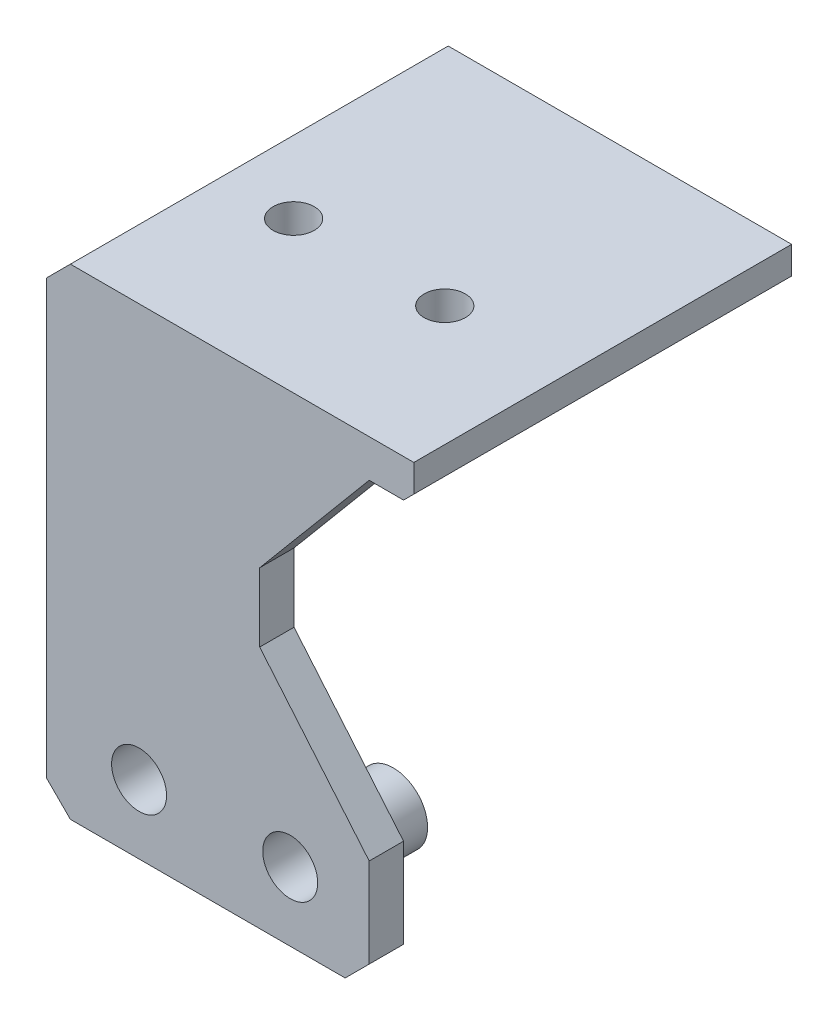
from build123d import *

# Parameters (mm, degrees)
BOSS_EXTRUDE1_DEPTH     = 5
BOSS_EXTRUDE2_DEPTH     = 50
SKETCH5_R               = 3
CUT_EXTRUDE1_DEPTH      = 94.713659623
SKETCH6_R               = 5
SKETCH6_R_2             = 4
BOSS_EXTRUDE3_DEPTH     = 10
SKETCH5_3_R             = 5
SKETCH5_3_R_2           = 3
CUT_EXTRUDE2_DEPTH      = 4
ESQUISSE1_R             = 4
ENL_V_MAT_EXTRU_1_DEPTH = 100.498743711


with BuildPart() as part:
    # Sketch1 → Boss-Extrude1 (new body)
    with BuildSketch(Plane.XY):
        Polygon((40, -70), (43.5, -66.5), (43.5, -53.5), (27.557107008, -34.5), (27.557107008, -24.5), (43.5, -5.5), (48.5, -5.5), (50, -4), (50, 0), (0, 0), (-3.5, -3.5), (-3.5, -66.5), (0, -70), align=None)
    extrude(amount=BOSS_EXTRUDE1_DEPTH)

    # Sketch4 → Boss-Extrude2 (add)
    with BuildSketch(Plane(origin=(0, 0, 0), x_dir=(-1, 0, 0), z_dir=(0, 0, -1))):
        Polygon((-50, 0), (-50, -4), (-45.5, -8.5), (3.5, -8.5), (3.5, -3.5), (0, 0), align=None)
    extrude(amount=BOSS_EXTRUDE2_DEPTH)

    # Sketch5 → Cut-Extrude1 (cut, through all)
    with BuildSketch(Plane.XZ.offset(8.5)):
        with Locations((32.5, -17)):
            Circle(SKETCH5_R)
        with Locations((10.5, -17)):
            Circle(SKETCH5_R)
    extrude(amount=-CUT_EXTRUDE1_DEPTH, mode=Mode.SUBTRACT)

    # Sketch6 → Boss-Extrude3 (add)
    # profile 1 of 2: a face of its own
    with BuildSketch(Plane(origin=(0, 0, 0), x_dir=(-1, 0, 0), z_dir=(0, 0, -1))):
        with Locations((-10, -60)):
            Circle(SKETCH6_R)
        with Locations((-10, -60)):
            Circle(SKETCH6_R_2, mode=Mode.SUBTRACT)
    # profile 2 of 2: a face of its own
    with BuildSketch(Plane(origin=(0, 0, 0), x_dir=(-1, 0, 0), z_dir=(0, 0, -1))):
        with Locations((-32, -60)):
            Circle(SKETCH6_R)
        with Locations((-32, -60)):
            Circle(SKETCH6_R_2, mode=Mode.SUBTRACT)
    extrude(amount=BOSS_EXTRUDE3_DEPTH)

    # Sketch5<3> → Cut-Extrude2 (cut)
    # profile 1 of 2: a face of its own
    with BuildSketch(Plane.XZ.offset(8.5)):
        with Locations((10.5, -17)):
            Circle(SKETCH5_3_R)
        with Locations((10.5, -17)):
            Circle(SKETCH5_3_R_2, mode=Mode.SUBTRACT)
    # profile 2 of 2: a face of its own
    with BuildSketch(Plane.XZ.offset(8.5)):
        with Locations((32.5, -17)):
            Circle(SKETCH5_3_R)
        with Locations((32.5, -17)):
            Circle(SKETCH5_3_R_2, mode=Mode.SUBTRACT)
    extrude(amount=-CUT_EXTRUDE2_DEPTH, mode=Mode.SUBTRACT)

    # Esquisse1 → Enlèv. mat.-Extru.1 (cut, through all)
    with BuildSketch(Plane.XY):
        with Locations((10, -60)):
            Circle(ESQUISSE1_R)
        with Locations((32, -60)):
            Circle(ESQUISSE1_R)
    extrude(amount=ENL_V_MAT_EXTRU_1_DEPTH, mode=Mode.SUBTRACT)


solid = part.part
